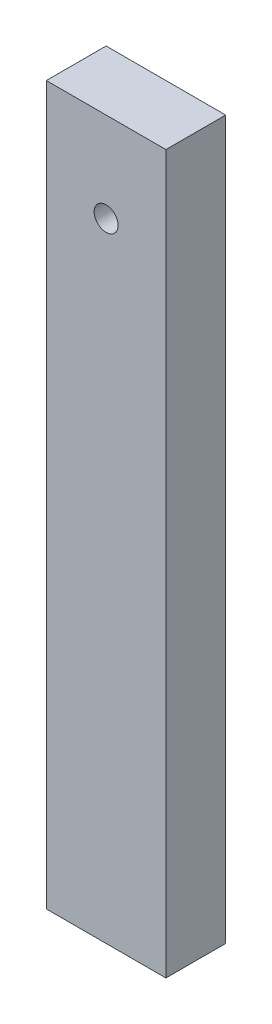
from build123d import *

# Parameters (mm, degrees)
SKETCH1_W           = 25.4
SKETCH1_H           = 12.7
BOSS_EXTRUDE2_DEPTH = 152.4
SKETCH2_R           = 2.54
CUT_EXTRUDE2_DEPTH  = 22.86


with BuildPart() as part:
    # Sketch1 → Boss-Extrude2 (new body)
    with BuildSketch(Plane(origin=(0, 0, 0), x_dir=(1, 0, 0), z_dir=(0, 1, 0))):
        with Locations((12.7, 6.35)):
            Rectangle(SKETCH1_W, SKETCH1_H)
    extrude(amount=BOSS_EXTRUDE2_DEPTH)

    # Sketch2 → Cut-Extrude2 (cut)
    with BuildSketch(Plane.XY):
        with Locations((12.7, 133.35)):
            Circle(SKETCH2_R)
    extrude(amount=-CUT_EXTRUDE2_DEPTH, mode=Mode.SUBTRACT)


solid = part.part
